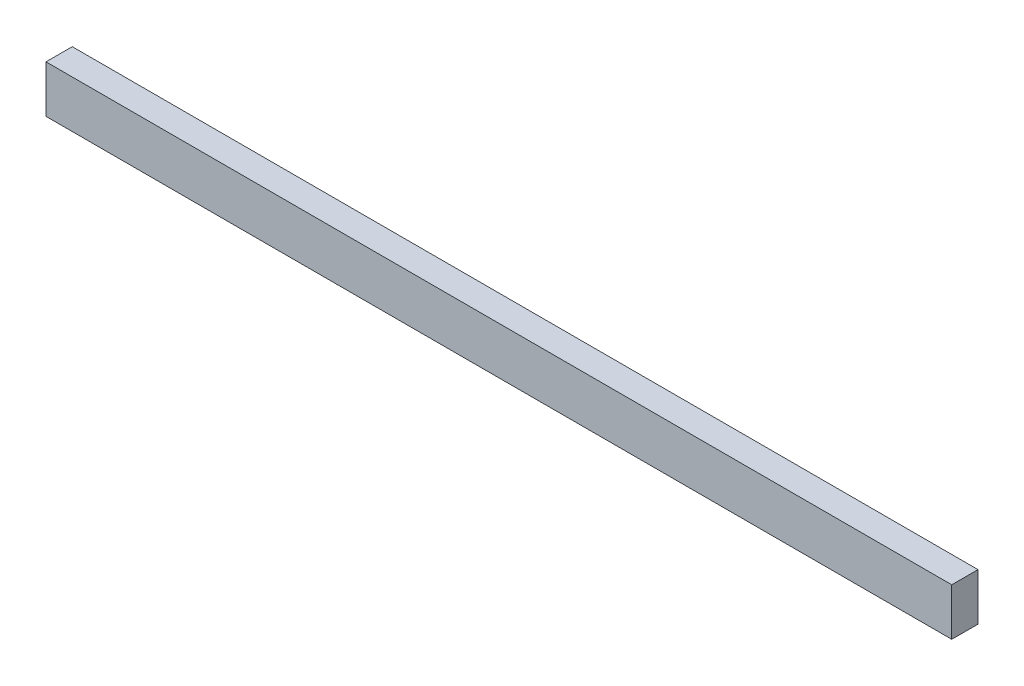
from build123d import *

# Parameters (mm, degrees)
SKETCH_1_W        = 690
SKETCH_1_H        = 36
CROSSMEMBER_DEPTH = 20


with BuildPart() as part:
    # 草图1 → Crossmember (new body)
    with BuildSketch(Plane.XY):
        with Locations((345, 18)):
            Rectangle(SKETCH_1_W, SKETCH_1_H)
    extrude(amount=CROSSMEMBER_DEPTH)


solid = part.part
